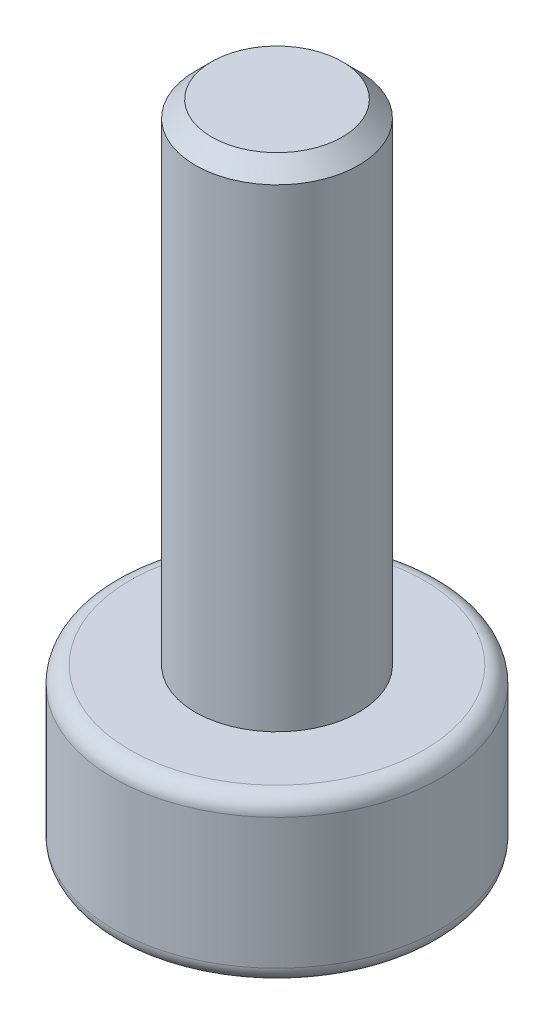
from build123d import *

# Parameters (mm, degrees)
SKETCH_2_R          = 2
EXTRUDE_1_DEPTH     = 2
SKETCH_3_R          = 1
EXTRUDE_2_DEPTH     = 6
FILLET_1_R          = 0.2
SKETCH_4_R          = 0.765
CUT_EXTRUDE_1_DEPTH = 1.52
CHAMFER_1_SIZE      = 0.1
CHAMFER_2_SIZE      = 0.2


with BuildPart() as part:
    # 草图2 → 凸台-拉伸1 (new body)
    with BuildSketch(Plane(origin=(0, 0, 0), x_dir=(1, 0, 0), z_dir=(0, 1, 0))):
        with Locations(Location((0, 0, 0), (0, 0, 270))):
            Circle(SKETCH_2_R)
    extrude(amount=EXTRUDE_1_DEPTH)

    # 草图3 → 凸台-拉伸2 (add)
    with BuildSketch(Plane(origin=(0, 2, 0), x_dir=(1, 0, 0), z_dir=(0, 1, 0))):
        with Locations(Location((0, 0, 0), (0, 0, 270))):
            Circle(SKETCH_3_R)
    extrude(amount=EXTRUDE_2_DEPTH)

    # 圆角1
    fillet_1_edges = [part.edges().sort_by_distance(p)[0] for p in [
        (0, 0, -2),
        (0, 2, -2),
    ]]
    fillet(fillet_1_edges, radius=FILLET_1_R)

    # 草图4 → 切除-拉伸1 (cut)
    with BuildSketch(Plane.XZ):
        with Locations(Location((0, 0, 0), (0, 0, 270))):
            Circle(SKETCH_4_R)
    extrude(amount=-CUT_EXTRUDE_1_DEPTH, mode=Mode.SUBTRACT)

    # 倒角1
    chamfer_1_edges = [part.edges().sort_by_distance(p)[0] for p in [
        (0, 0, 0.765),
    ]]
    chamfer(chamfer_1_edges, length=CHAMFER_1_SIZE)

    # 倒角2
    chamfer_2_edges = [part.edges().sort_by_distance(p)[0] for p in [
        (0, 8, -1),
    ]]
    chamfer(chamfer_2_edges, length=CHAMFER_2_SIZE)


solid = part.part
